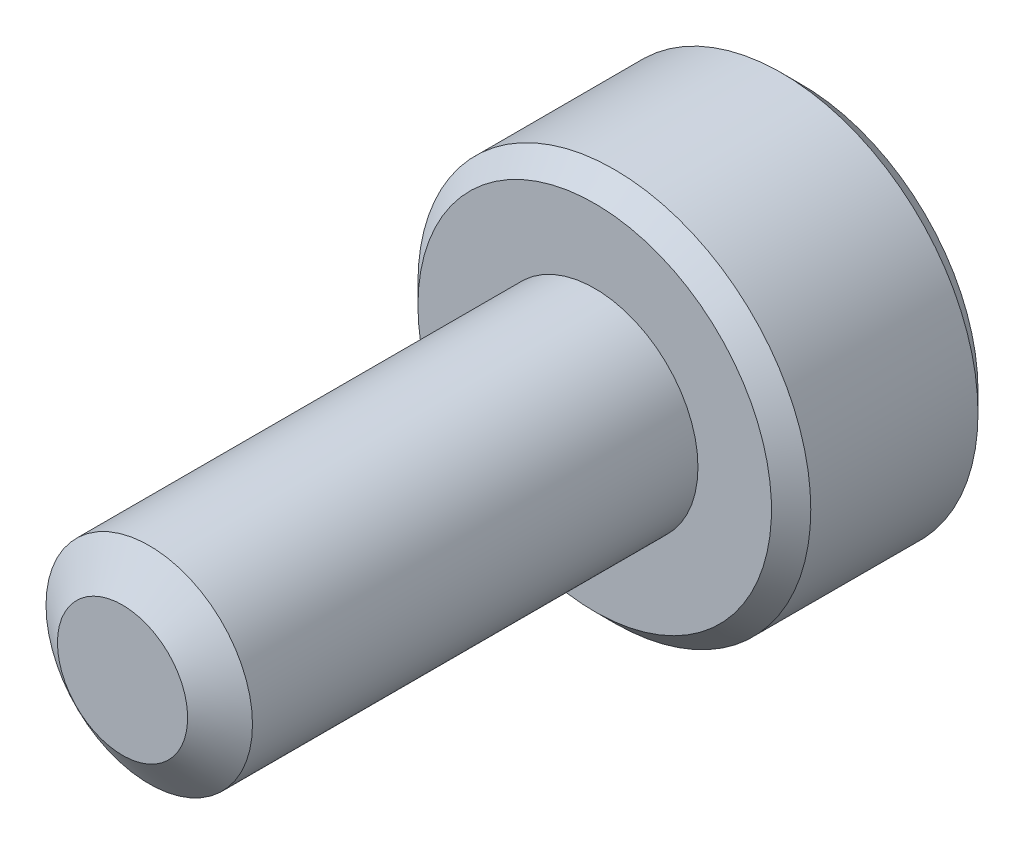
from build123d import *

# Parameters (mm, degrees)
SKETCH1_R           = 2.0828
BOSS_EXTRUDE1_DEPTH = 9.525
SKETCH3_R           = 3.9624
BOSS_EXTRUDE2_DEPTH = 4.1656
CUT_EXTRUDE1_START  = -4.1656
CUT_EXTRUDE1_DEPTH  = 2.67890625
CHAMFER1_SIZE       = 0.39624


with BuildPart() as part:
    # Sketch1 → Boss-Extrude1 (new body)
    with BuildSketch(Plane.XY):
        with Locations(Location((0, 0, 0), (0, 0, 180))):
            Circle(SKETCH1_R)
    extrude(amount=BOSS_EXTRUDE1_DEPTH)

    # Sketch2 → Cut-Revolve1 (revolve, cut)
    with BuildSketch(Plane(origin=(0, 0, 0), x_dir=(0, 0, -1), z_dir=(1, 0, 0)), mode=Mode.PRIVATE) as cut_revolve1_sk:
        Polygon((-9.525, 2.0828), (-9.525, 1.313244262), (-8.986151271, 2.0828), align=None)
    revolve(cut_revolve1_sk.sketch.rotate(Axis((0, 0, 0), (0, 0, 1)), 90), axis=Axis((0, 0, 0), (0, 0, 1)), mode=Mode.SUBTRACT)

    # Sketch3 → Boss-Extrude2 (add)
    with BuildSketch(Plane.XY):
        Circle(SKETCH3_R)
    extrude(amount=-BOSS_EXTRUDE2_DEPTH)

    # Sketch4 → Cut-Extrude1 (cut)
    with BuildSketch(Plane.XY.offset(CUT_EXTRUDE1_START)):
        Polygon((0, -2.062222993), (1.7859375, -1.031111496), (1.7859375, 1.031111496), (0, 2.062222993), (-1.7859375, 1.031111496), (-1.7859375, -1.031111496), align=None)
    extrude(amount=CUT_EXTRUDE1_DEPTH, mode=Mode.SUBTRACT)

    # Cut-Extrude2 cone 1 section (through the dimple's axis) → Cut-Extrude2 (revolve, cut)
    with BuildSketch(Plane(origin=(0, 0, -4.1656), x_dir=(0, 1, 0), z_dir=(1, 0, 0))):
        Polygon((0, 0), (2.062222993, 0), (0, 2.062222993), align=None)
    revolve(axis=Axis((0, 0, -4.1656), (0, 0, 1)), mode=Mode.SUBTRACT)

    # Chamfer1
    chamfer1_edges = [part.edges().sort_by_distance(p)[0] for p in [
        (-3.9624, 0, -4.1656),
        (-3.9624, 0, 0),
    ]]
    chamfer(chamfer1_edges, length=CHAMFER1_SIZE)


solid = part.part
